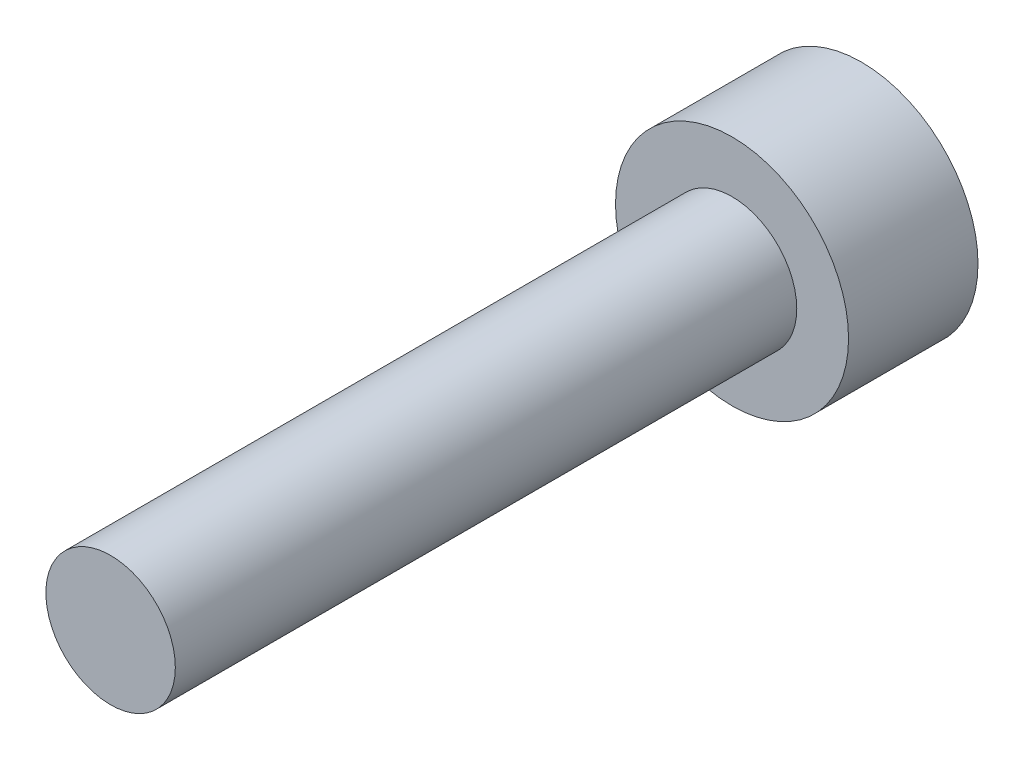
from build123d import *

# Parameters (mm, degrees)
SKETCH_1_R          = 2.25
EXTRUDE_1_DEPTH     = 2.5
SKETCH_2_R          = 1.25
EXTRUDE_2_DEPTH     = 12
CUT_EXTRUDE_1_DEPTH = 1


with BuildPart() as part:
    # 草图1 → 凸台-拉伸1 (new body)
    with BuildSketch(Plane.XY):
        Circle(SKETCH_1_R)
    extrude(amount=EXTRUDE_1_DEPTH)

    # 草图2 → 凸台-拉伸2 (add)
    with BuildSketch(Plane.XY.offset(2.5)):
        Circle(SKETCH_2_R)
    extrude(amount=EXTRUDE_2_DEPTH)

    # 草图3 → 切除-拉伸1 (cut)
    with BuildSketch(Plane(origin=(0, 0, 0), x_dir=(-1, 0, 0), z_dir=(0, 0, -1))):
        Polygon((1.154700538, 0), (0.577350269, 1), (-0.577350269, 1), (-1.154700538, 0), (-0.577350269, -1), (0.577350269, -1), align=None)
    extrude(amount=-CUT_EXTRUDE_1_DEPTH, mode=Mode.SUBTRACT)


solid = part.part
